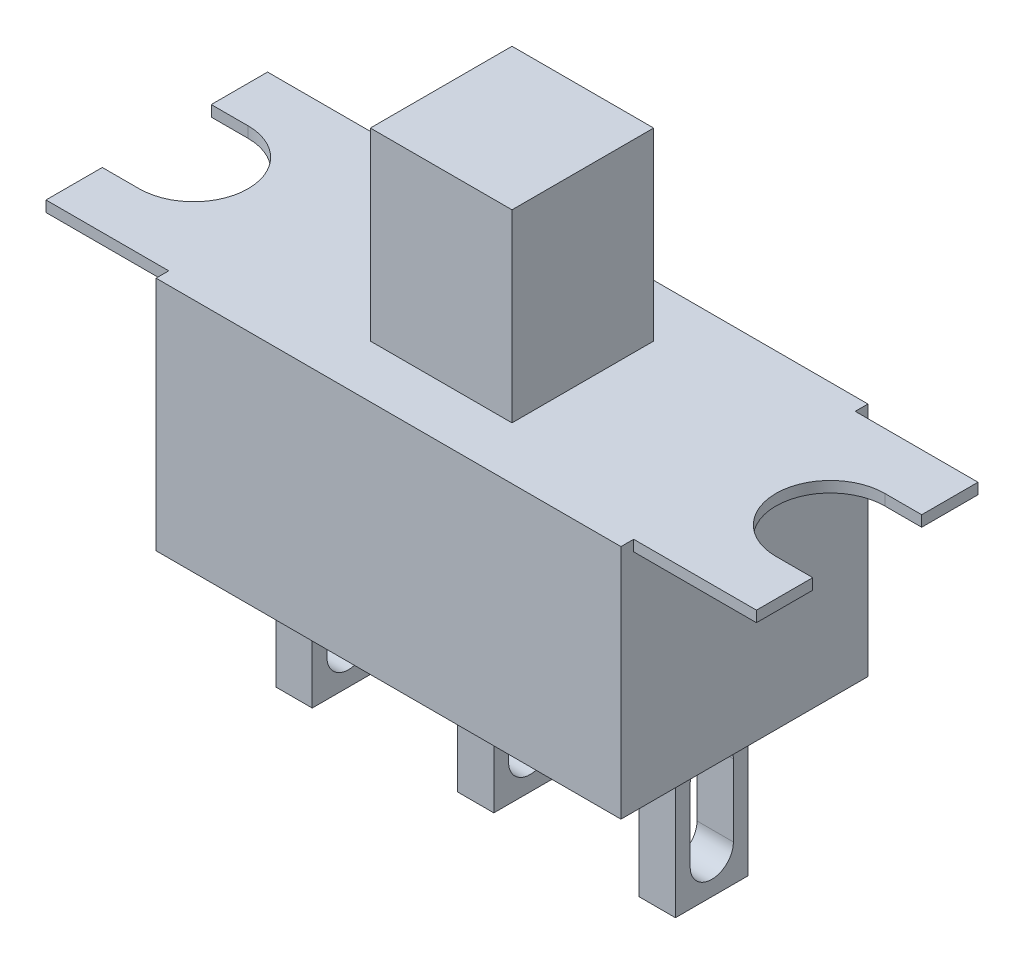
from build123d import *

# Parameters (mm, degrees)
SKETCH1_W           = 12.8
SKETCH1_H           = 6.8
BOSS_EXTRUDE1_DEPTH = 6.5
BOSS_EXTRUDE2_DEPTH = 0.3
SKETCH3_W           = 3.9
SKETCH3_H           = 3.9
BOSS_EXTRUDE3_DEPTH = 5.08
SKETCH4_W           = 1
SKETCH4_H           = 2
BOSS_EXTRUDE4_DEPTH = 4
CUT_EXTRUDE1_DEPTH  = 20.471384132


with BuildPart() as part:
    # Sketch1 → Boss-Extrude1 (new body)
    with BuildSketch(Plane(origin=(0, 0, 0), x_dir=(1, 0, 0), z_dir=(0, 1, 0))):
        Rectangle(SKETCH1_W, SKETCH1_H)
    extrude(amount=BOSS_EXTRUDE1_DEPTH)

    # Sketch2 → Boss-Extrude2 (add)
    with BuildSketch(Plane(origin=(0, 6.5, 0), x_dir=(1, 0, 0), z_dir=(0, 1, 0))):
        with BuildLine():
            Line((9.78, 3.05), (-9.78, 3.05))
            Line((-9.78, 3.05), (-9.78, 1.5))
            Line((-9.78, 1.5), (-8.765, 1.5))
            ThreePointArc((-8.765, 1.5), (-7.265, 0), (-8.765, -1.5))
            Line((-8.765, -1.5), (-9.78, -1.5))
            Line((-9.78, -1.5), (-9.78, -3.05))
            Line((-9.78, -3.05), (9.78, -3.05))
            Line((9.78, -3.05), (9.78, -1.5))
            Line((9.78, -1.5), (8.765, -1.5))
            ThreePointArc((8.765, -1.5), (7.265, 0), (8.765, 1.5))
            Line((8.765, 1.5), (9.78, 1.5))
            Line((9.78, 1.5), (9.78, 3.05))
        make_face()
    extrude(amount=-BOSS_EXTRUDE2_DEPTH)

    # Sketch3 → Boss-Extrude3 (add)
    with BuildSketch(Plane(origin=(0, 6.5, 0), x_dir=(1, 0, 0), z_dir=(0, 1, 0))):
        Rectangle(SKETCH3_W, SKETCH3_H)
    extrude(amount=BOSS_EXTRUDE3_DEPTH)

    # Sketch4 → Boss-Extrude4 (add)
    with BuildSketch(Plane.XZ):
        Rectangle(SKETCH4_W, SKETCH4_H)
        with Locations((5, 0)):
            Rectangle(SKETCH4_W, SKETCH4_H)
        with Locations((-5, 0)):
            Rectangle(SKETCH4_W, SKETCH4_H)
    extrude(amount=BOSS_EXTRUDE4_DEPTH)

    # Sketch5 → Cut-Extrude1 (cut, through all)
    with BuildSketch(Plane(origin=(5.5, 0, 0), x_dir=(0, 0, -1), z_dir=(1, 0, 0))):
        with BuildLine():
            Line((0.595, -1.01), (0.595, -2.99))
            ThreePointArc((0.595, -2.99), (0, -3.585), (-0.595, -2.99))
            Line((-0.595, -2.99), (-0.595, -1.01))
            ThreePointArc((-0.595, -1.01), (0, -0.415), (0.595, -1.01))
        make_face()
    extrude(amount=-CUT_EXTRUDE1_DEPTH, mode=Mode.SUBTRACT)


solid = part.part
